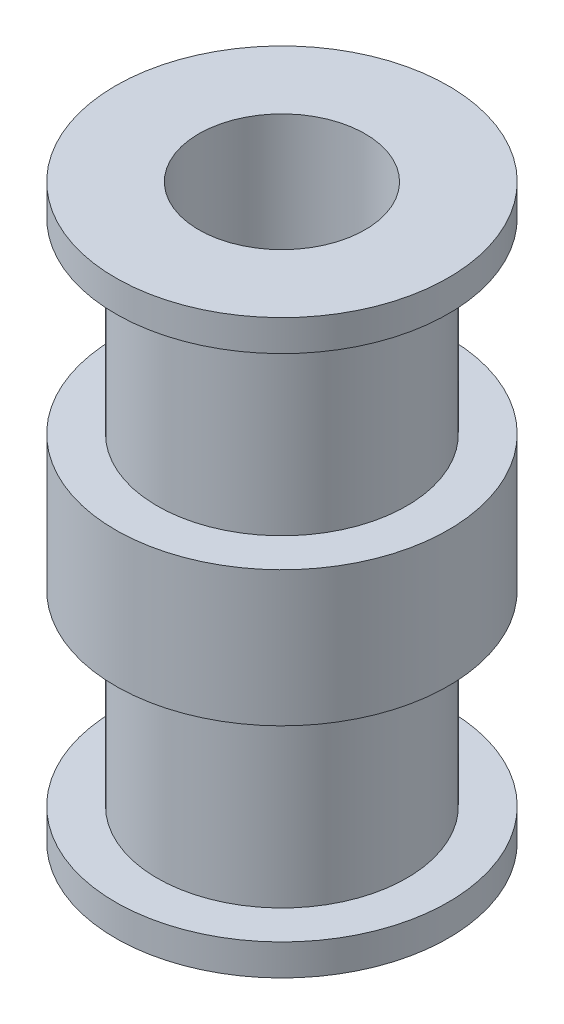
from build123d import *

# Parameters (mm, degrees)
CUT_EXTRUDE1_REACH = 31.736
SKETCH2_R          = 4
SKETCH3_R          = 1.25
CUT_EXTRUDE2_DEPTH = 10
CIRPATTERN1_COUNT  = 2
CIRPATTERN1_ANGLE  = 90


with BuildPart() as part:
    # Sketch1 → Revolve1 (revolve)
    with BuildSketch(Plane.XY):
        Polygon((0, 5), (-8, 5), (-8, 3.5), (-6, 3.5), (-6, -5.5), (-8, -5.5), (-8, -12), (-6, -12), (-6, -21), (-8, -21), (-8, -22.5), (0, -22.5), align=None)
    revolve(axis=Axis((0, 291.267844828, 0), (0, -1, 0)))

    # Sketch2 → Cut-Extrude1 (cut, up to next)
    with BuildSketch(Plane(origin=(0, 5, 0), x_dir=(1, 0, 0), z_dir=(0, 1, 0)), mode=Mode.PRIVATE) as cut_extrude1_sk1:
        with Locations(Location((0, 0, 0), (0, 0, 180))):
            Circle(SKETCH2_R)
    cut_extrude1_tool1 = extrude(cut_extrude1_sk1.sketch, amount=-CUT_EXTRUDE1_REACH, mode=Mode.PRIVATE) & part.part
    add(cut_extrude1_tool1.solids().sort_by_distance((0, 5, 0))[0], mode=Mode.SUBTRACT)

    # Sketch3 → Cut-Extrude2 (cut)
    with BuildSketch(Plane.XY):
        with Locations((0, -8.820149855)):
            Circle(SKETCH3_R)
    cut_extrude2 = extrude(amount=-CUT_EXTRUDE2_DEPTH, mode=Mode.SUBTRACT)

    # CirPattern1: Cut-Extrude2 ×2 about axis
    cirpattern1_axis = Axis((0, -22.5, 0), (0, 1, 0))
    for i in range(1, CIRPATTERN1_COUNT):
        add(cut_extrude2.rotate(cirpattern1_axis, i * CIRPATTERN1_ANGLE / (CIRPATTERN1_COUNT - 1)), mode=Mode.SUBTRACT)


solid = part.part
